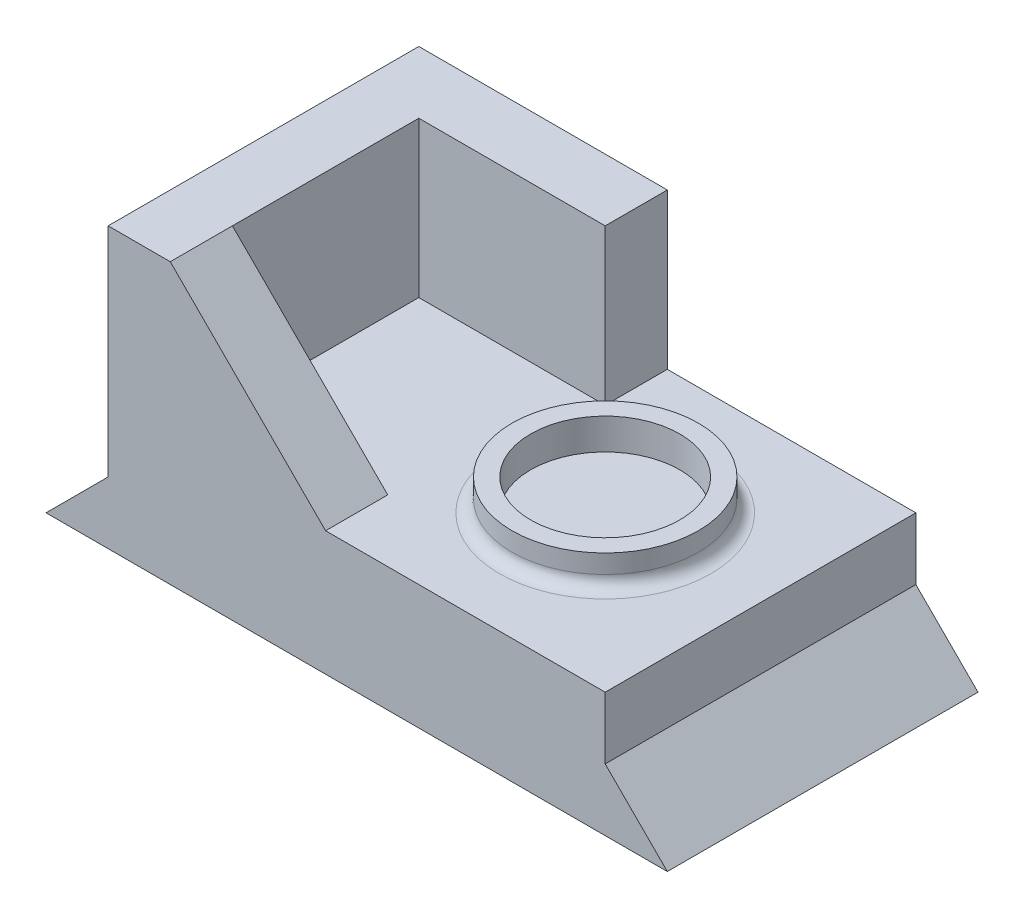
from build123d import *

# Parameters (mm, degrees)
BOSS_EXTRUDE1_DEPTH = 50
BOSS_EXTRUDE2_START = 50
BOSS_EXTRUDE2_DEPTH = 10
SKETCH2_R           = 15
SKETCH2_R_2         = 12
BOSS_EXTRUDE3_DEPTH = 5
BOSS_EXTRUDE4_DEPTH = 25
FILLET1_R           = 2


with BuildPart() as part:
    # Sketch1 → Boss-Extrude1 (new body)
    with BuildSketch(Plane.XY):
        Polygon((10, 10), (0, 0), (100, 0), (90, 10), (90, 20), (45, 20), (10, 20), align=None)
    extrude(amount=BOSS_EXTRUDE1_DEPTH)

    # Sketch1<4> → Boss-Extrude2 (add)
    with BuildSketch(Plane.XY.offset(BOSS_EXTRUDE2_START)):
        Polygon((10, 45), (10, 20), (45, 20), (20, 45), align=None)
    extrude(amount=-BOSS_EXTRUDE2_DEPTH)

    # Sketch2 → Boss-Extrude3 (add)
    with BuildSketch(Plane(origin=(0, 20, 0), x_dir=(1, 0, 0), z_dir=(0, 1, 0))):
        with Locations((65, -25)):
            Circle(SKETCH2_R)
        with Locations(Location((65, -25, 0), (0, 0, 180))):
            Circle(SKETCH2_R_2, mode=Mode.SUBTRACT)
    extrude(amount=BOSS_EXTRUDE3_DEPTH)

    # Sketch2<3> → Boss-Extrude4 (add)
    with BuildSketch(Plane(origin=(0, 20, 0), x_dir=(1, 0, 0), z_dir=(0, 1, 0))):
        Polygon((10, -40), (20, -40), (20, -10), (50, -10), (50, 0), (10, 0), align=None)
    extrude(amount=BOSS_EXTRUDE4_DEPTH)

    # Fillet1
    fillet1_edges = [part.edges().sort_by_distance(p)[0] for p in [
        (50, 20, 25),
    ]]
    fillet(fillet1_edges, radius=FILLET1_R)


solid = part.part
